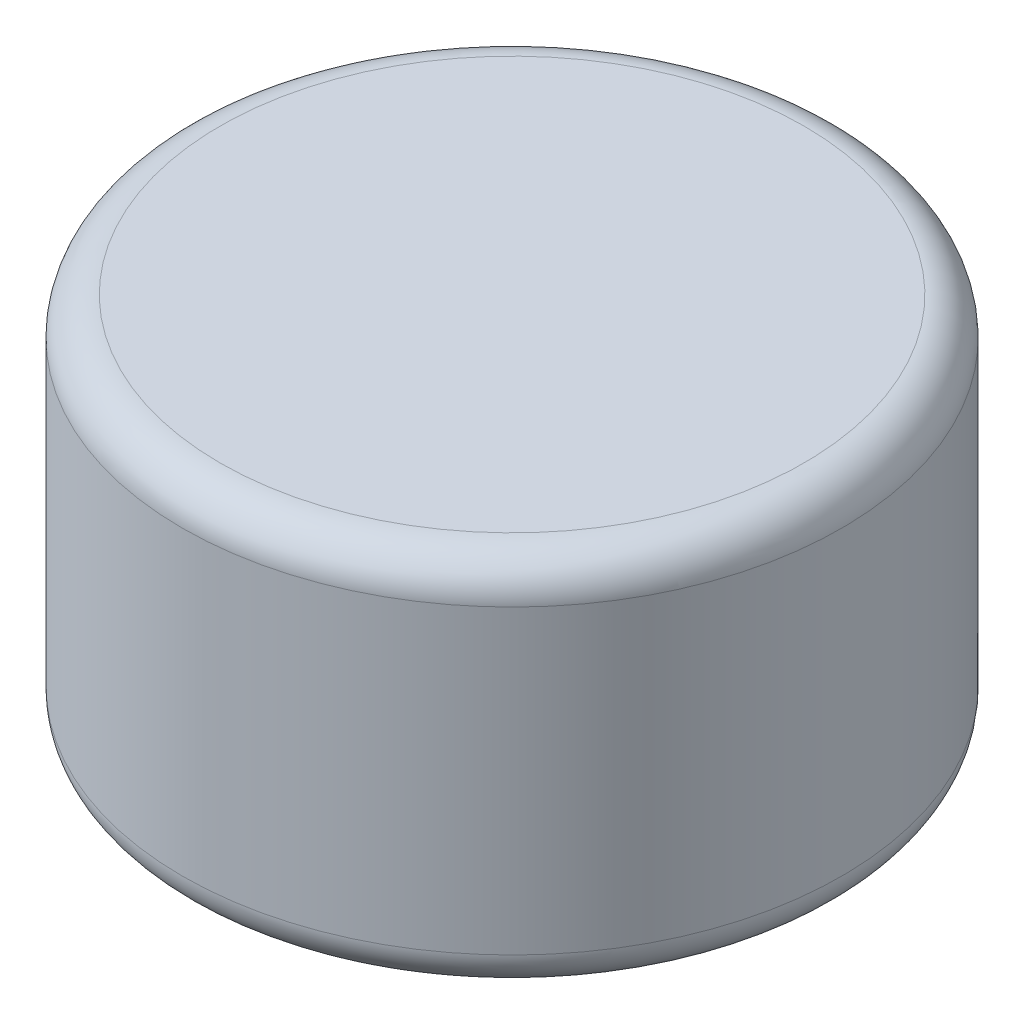
from build123d import *

# Parameters (mm, degrees)
SKETCH1_R           = 5.55625
BOSS_EXTRUDE1_DEPTH = 3.175
FILLET1_R           = 0.635


with BuildPart() as part:
    # Sketch1 → Boss-Extrude1 (new, symmetric)
    with BuildSketch(Plane(origin=(0, 0, 0), x_dir=(1, 0, 0), z_dir=(0, 1, 0))):
        with Locations(Location((0, 0, 0), (0, 0, 270))):
            Circle(SKETCH1_R)
    extrude(amount=BOSS_EXTRUDE1_DEPTH, both=True)

    # Fillet1
    fillet1_edges = [part.edges().sort_by_distance(p)[0] for p in [
        (0, -3.175, -5.55625),
        (0, 3.175, -5.55625),
    ]]
    fillet(fillet1_edges, radius=FILLET1_R)


solid = part.part
